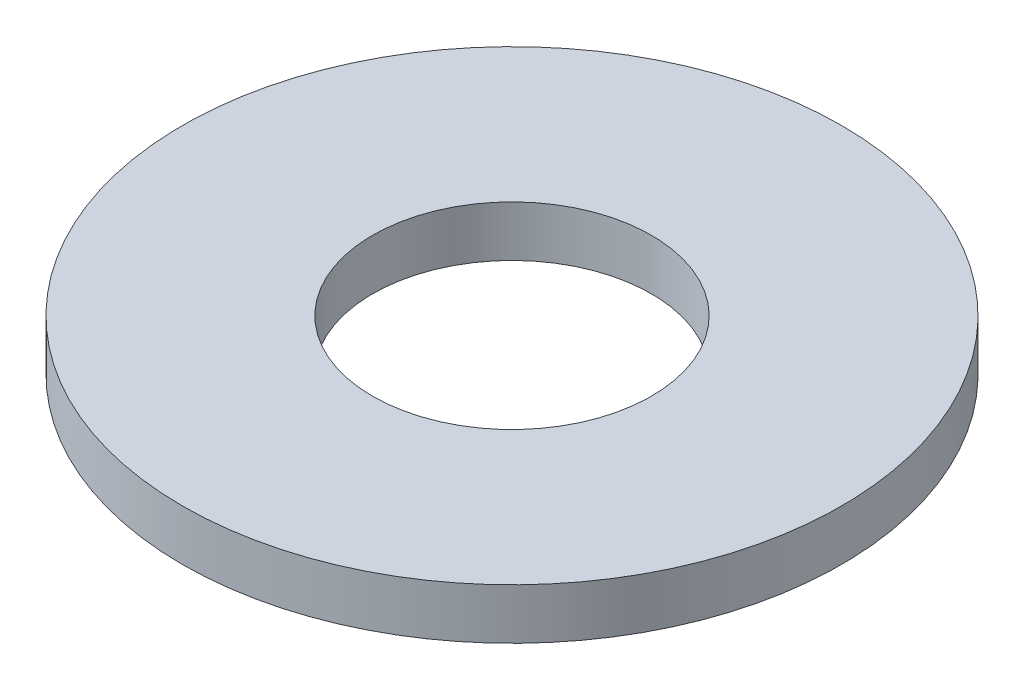
from build123d import *

# Parameters (mm, degrees)
SKETCH1_R           = 13
SKETCH1_R_2         = 5.5
BOSS_EXTRUDE1_DEPTH = 2


with BuildPart() as part:
    # Sketch1 → Boss-Extrude1 (new body)
    with BuildSketch(Plane(origin=(0, 0, 0), x_dir=(1, 0, 0), z_dir=(0, 1, 0))):
        with Locations(Location((0, 0, 0), (0, 0, 270))):
            Circle(SKETCH1_R)
        with Locations(Location((0, 0, 0), (0, 0, 270))):
            Circle(SKETCH1_R_2, mode=Mode.SUBTRACT)
    extrude(amount=BOSS_EXTRUDE1_DEPTH)


solid = part.part
